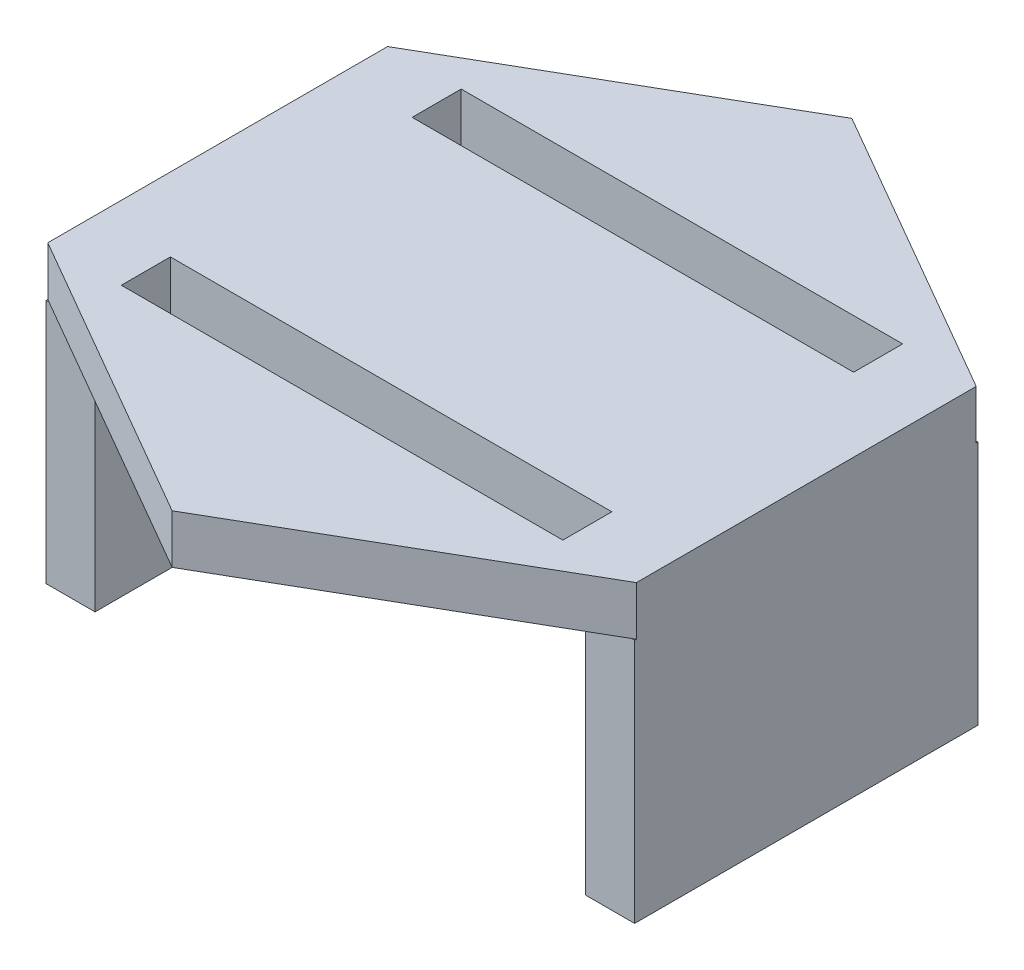
from build123d import *

# Parameters (mm, degrees)
SKETCH1_W             = 12.7
SKETCH1_H             = 88.9
BOSS_EXTRUDE1_DEPTH   = 63.5
BOSS_EXTRUDE1_2_DEPTH = 63.5
BOSS_EXTRUDE2_DEPTH   = 12.7
SKETCH3_W             = 114.3
SKETCH3_H             = 12.7
CUT_EXTRUDE1_DEPTH    = 208.03236895


with BuildPart() as part:
    # Sketch1 → Boss-Extrude1 (new body)
    with BuildSketch(Plane(origin=(0, 0, 0), x_dir=(1, 0, 0), z_dir=(0, 1, 0))):
        with Locations((6.35, 44.45)):
            Rectangle(SKETCH1_W, SKETCH1_H)
    extrude(amount=BOSS_EXTRUDE1_DEPTH)



with BuildPart() as body_2:
    # Sketch1 → Boss-Extrude1 2 (new body)
    with BuildSketch(Plane(origin=(0, 0, 0), x_dir=(1, 0, 0), z_dir=(0, 1, 0))):
        with Locations((-133.35, 44.45)):
            Rectangle(SKETCH1_W, SKETCH1_H)
    extrude(amount=BOSS_EXTRUDE1_2_DEPTH)


with BuildPart() as part_1:
    add(part.part)

    add(body_2.part)  # Boss-Extrude2 merges body 2
    # Sketch2 → Boss-Extrude2 (add)
    with BuildSketch(Plane(origin=(0, 63.5, 0), x_dir=(1, 0, 0), z_dir=(0, 1, 0))):
        Polygon((-63.5, -43.538181024), (12.7, 0.455909488), (12.7, 88.444090512), (-63.5, 132.438181024), (-139.7, 88.444090512), (-139.7, 0.455909488), align=None)
    extrude(amount=BOSS_EXTRUDE2_DEPTH)

    # Sketch3 → Cut-Extrude1 (cut, through all)
    with BuildSketch(Plane(origin=(0, 76.2, 0), x_dir=(1, 0, 0), z_dir=(0, 1, 0))):
        with Locations((-63.5, 6.805909488)):
            Rectangle(SKETCH3_W, SKETCH3_H)
        with Locations((-63.5, 82.094090512)):
            Rectangle(SKETCH3_W, SKETCH3_H)
    extrude(amount=-CUT_EXTRUDE1_DEPTH, mode=Mode.SUBTRACT)


solid = part_1.part
